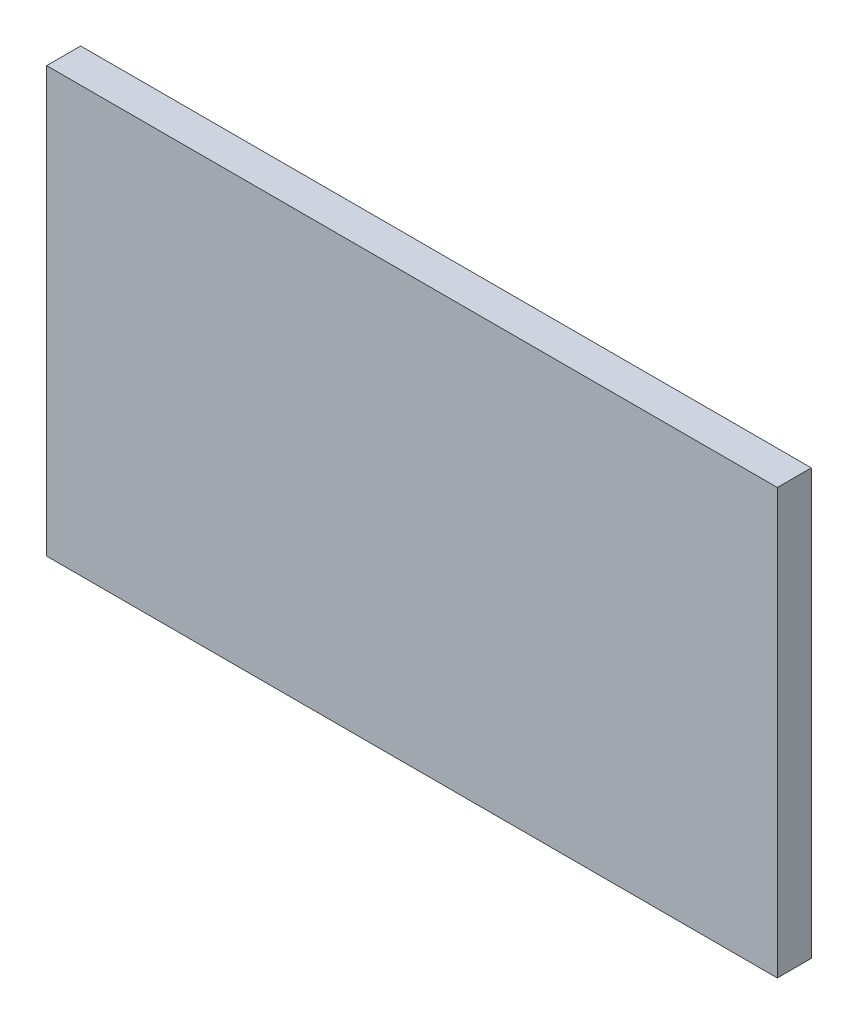
from build123d import *

# Parameters (mm, degrees)
SKETCH1_W           = 86
SKETCH1_H           = 50
BOSS_EXTRUDE1_DEPTH = 4


with BuildPart() as part:
    # Sketch1 → Boss-Extrude1 (new body)
    with BuildSketch(Plane.XY):
        with Locations((43, 25)):
            Rectangle(SKETCH1_W, SKETCH1_H)
    extrude(amount=BOSS_EXTRUDE1_DEPTH)


solid = part.part
